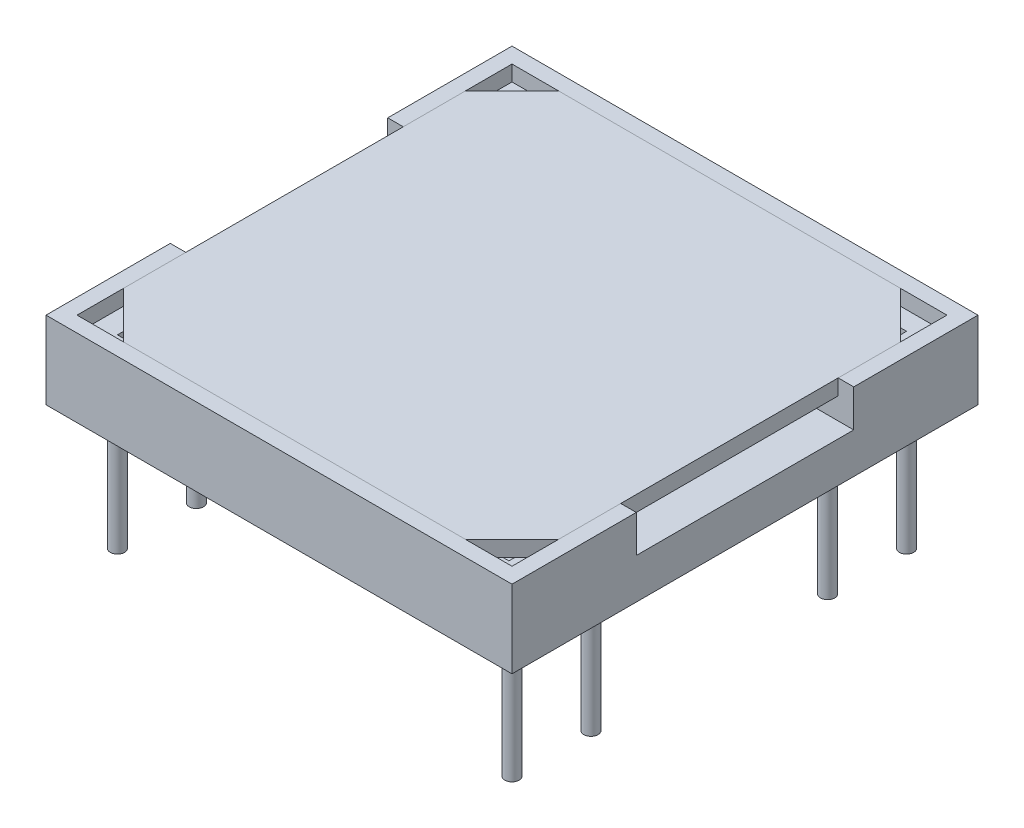
from build123d import *

# Parameters (mm, degrees)
SKETCH1_W           = 15
SKETCH1_H           = 15
BOSS_EXTRUDE1_DEPTH = 0.61
BOSS_EXTRUDE2_START = 0.61
SKETCH1_3_W         = 5.85
SKETCH1_3_H         = 5.95
BOSS_EXTRUDE2_DEPTH = 0.69
BOSS_EXTRUDE3_START = 0.61
SKETCH1_4_W         = 0.5
SKETCH1_4_H         = 7
BOSS_EXTRUDE3_DEPTH = 1.39
BOSS_EXTRUDE4_START = 2
SKETCH1_7_W         = 0.5
SKETCH1_7_H         = 7
BOSS_EXTRUDE4_DEPTH = 0.5
CUT_EXTRUDE1_START  = 2.5
SKETCH1_6_W         = 0.5
SKETCH1_6_H         = 7
CUT_EXTRUDE1_DEPTH  = 1.2
SKETCH2_R           = 0.23
BOSS_EXTRUDE5_DEPTH = 3.999992
BOSS_EXTRUDE6_DEPTH = 0.5


with BuildPart() as part:
    # Sketch1 → Boss-Extrude1 (new body)
    with BuildSketch(Plane(origin=(0, 0, 0), x_dir=(1, 0, 0), z_dir=(0, 1, 0))):
        Rectangle(SKETCH1_W, SKETCH1_H)
    extrude(amount=BOSS_EXTRUDE1_DEPTH)

    # Sketch1<3> → Boss-Extrude2 (add)
    with BuildSketch(Plane(origin=(0, 0, 0), x_dir=(1, 0, 0), z_dir=(0, 1, 0)).offset(BOSS_EXTRUDE2_START)):
        with Locations((-3.175, 3.225)):
            Rectangle(SKETCH1_3_W, SKETCH1_3_H)
        with Locations((-3.175, -3.225)):
            Rectangle(SKETCH1_3_W, SKETCH1_3_H)
        with Locations((3.175, -3.225)):
            Rectangle(SKETCH1_3_W, SKETCH1_3_H)
        with Locations((3.175, 3.225)):
            Rectangle(SKETCH1_3_W, SKETCH1_3_H)
    extrude(amount=BOSS_EXTRUDE2_DEPTH)

    # Sketch1<4> → Boss-Extrude3 (add)
    with BuildSketch(Plane(origin=(0, 0, 0), x_dir=(1, 0, 0), z_dir=(0, 1, 0)).offset(BOSS_EXTRUDE3_START)):
        Polygon((-7.5, 7.5), (-7.5, 3.5), (-7, 3.5), (-7, 7), (7, 7), (7, 3.5), (7.5, 3.5), (7.5, 7.5), align=None)
        Polygon((-7, 7), (-7, 3.5), (-6.3, 3.5), (-6.3, 6.4), (-0.05, 6.4), (0.05, 6.4), (6.3, 6.4), (6.3, 3.5), (7, 3.5), (7, 7), align=None)
        with Locations((-7.25, 0)):
            Rectangle(SKETCH1_4_W, SKETCH1_4_H)
        Polygon((-7, 3.5), (-7, -3.5), (-6.3, -3.5), (-6.3, -0.05), (-6.3, 0.05), (-6.3, 3.5), align=None)
        Polygon((-7.5, -3.5), (-7.5, -7.5), (7.5, -7.5), (7.5, -3.5), (7, -3.5), (7, -7), (-7, -7), (-7, -3.5), align=None)
        Polygon((-6.3, -3.5), (-7, -3.5), (-7, -7), (7, -7), (7, -3.5), (6.3, -3.5), (6.3, -6.4), (0.05, -6.4), (-0.05, -6.4), (-6.3, -6.4), align=None)
        Polygon((6.3, -3.5), (7, -3.5), (7, 3.5), (6.3, 3.5), (6.3, 0.05), (6.3, -0.05), align=None)
        with Locations((7.25, 0)):
            Rectangle(SKETCH1_4_W, SKETCH1_4_H)
    extrude(amount=BOSS_EXTRUDE3_DEPTH)

    # Sketch1<7> → Boss-Extrude4 (add)
    with BuildSketch(Plane(origin=(0, 0, 0), x_dir=(1, 0, 0), z_dir=(0, 1, 0)).offset(BOSS_EXTRUDE4_START)):
        Polygon((-7.5, 7.5), (-7.5, 3.5), (-7, 3.5), (-7, 7), (7, 7), (7, 3.5), (7.5, 3.5), (7.5, 7.5), align=None)
        with Locations((-7.25, 0)):
            Rectangle(SKETCH1_7_W, SKETCH1_7_H)
        Polygon((-7.5, -3.5), (-7.5, -7.5), (7.5, -7.5), (7.5, -3.5), (7, -3.5), (7, -7), (-7, -7), (-7, -3.5), align=None)
        with Locations((7.25, 0)):
            Rectangle(SKETCH1_7_W, SKETCH1_7_H)
    extrude(amount=BOSS_EXTRUDE4_DEPTH)

    # Sketch1<6> → Cut-Extrude1 (cut)
    with BuildSketch(Plane(origin=(0, 0, 0), x_dir=(1, 0, 0), z_dir=(0, 1, 0)).offset(CUT_EXTRUDE1_START)):
        with Locations((-7.25, 0)):
            Rectangle(SKETCH1_6_W, SKETCH1_6_H)
        with Locations((7.25, 0)):
            Rectangle(SKETCH1_6_W, SKETCH1_6_H)
        Polygon((-7, 3.5), (-7, -3.5), (-6.3, -3.5), (-6.3, -0.05), (-6.3, 0.05), (-6.3, 3.5), align=None)
        Polygon((6.3, -3.5), (7, -3.5), (7, 3.5), (6.3, 3.5), (6.3, 0.05), (6.3, -0.05), align=None)
    extrude(amount=-CUT_EXTRUDE1_DEPTH, mode=Mode.SUBTRACT)

    # Sketch2 → Boss-Extrude5 (add)
    with BuildSketch(Plane.XZ):
        with Locations(Location((6.35, 6.35, 0), (0, 0, 90))):
            Circle(SKETCH2_R)
        with Locations(Location((6.35, 3.81, 0), (0, 0, 90))):
            Circle(SKETCH2_R)
        with Locations(Location((-6.35, 3.81, 0), (0, 0, 90))):
            Circle(SKETCH2_R)
        with Locations(Location((-6.35, 6.35, 0), (0, 0, 90))):
            Circle(SKETCH2_R)
        with Locations(Location((6.35, -3.81, 0), (0, 0, 90))):
            Circle(SKETCH2_R)
        with Locations(Location((6.35, -6.35, 0), (0, 0, 90))):
            Circle(SKETCH2_R)
        with Locations(Location((-6.35, -6.35, 0), (0, 0, 90))):
            Circle(SKETCH2_R)
        with Locations(Location((-6.35, -3.81, 0), (0, 0, 90))):
            Circle(SKETCH2_R)
    extrude(amount=BOSS_EXTRUDE5_DEPTH)


with BuildPart() as body_2:
    # Sketch3 → Boss-Extrude6 (new body)
    with BuildSketch(Plane(origin=(0, 2, 0), x_dir=(1, 0, 0), z_dir=(0, 1, 0))):
        Polygon((6.3, -6.199999978), (7, -5.5), (7, -3.5), (6.3, -3.5), align=None)
        Polygon((6.099999971, -6.4), (6.3, -6.199999978), (6.3, -3.5), (7, -3.5), (7, 5.5), (5.499999952, 7), (-5.499999952, 7), (-7, 5.5), (-7, -3.5), (-6.3, -3.5), (-6.3, -6.199999978), (-6.099999971, -6.4), align=None)
        Polygon((5.499999952, -7), (6.099999971, -6.4), (-6.099999971, -6.4), (-5.499999952, -7), align=None)
        Polygon((-7, -5.5), (-6.3, -6.199999978), (-6.3, -3.5), (-7, -3.5), align=None)
    extrude(amount=BOSS_EXTRUDE6_DEPTH)


solid = Compound([part.part, body_2.part])
